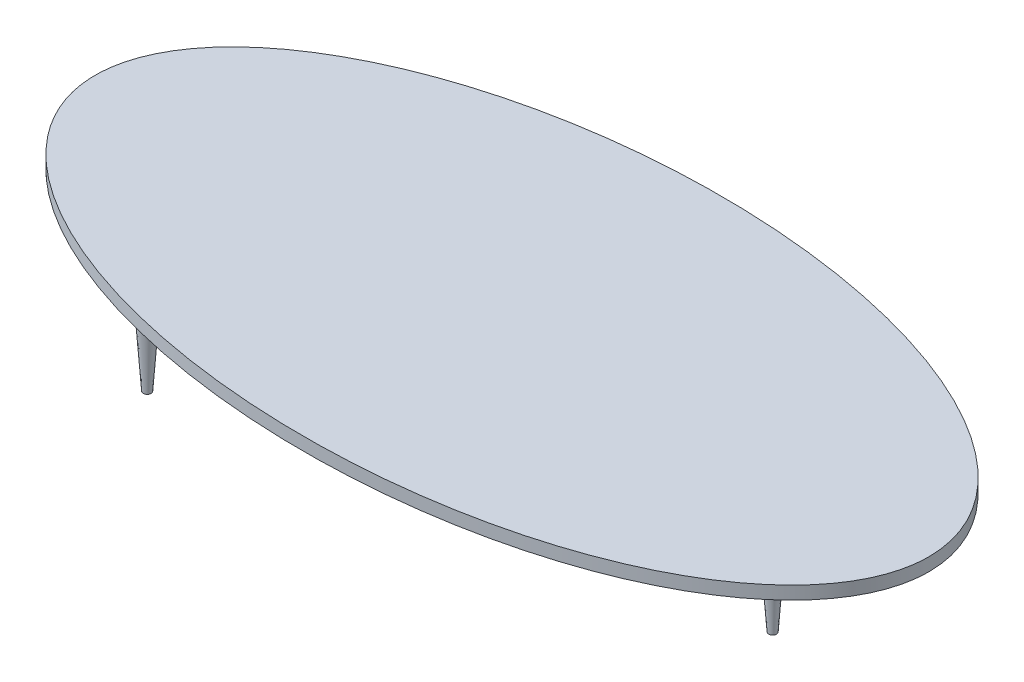
from build123d import *

# Parameters (mm, degrees)
SKETCH2_RX                    = 2438.4
SKETCH2_RY                    = 1219.2
BOSS_EXTRUDE2_DEPTH           = 76.2
SKETCH3_R                     = 76.2
BOSS_EXTRUDE3_DEPTH           = 762
BOSS_EXTRUDE3_DRAFT           = 4
BOSS_EXTRUDE3_PROFILE_2_DEPTH = 762
BOSS_EXTRUDE3_PROFILE_2_DRAFT = 4
BOSS_EXTRUDE3_PROFILE_3_DEPTH = 762
BOSS_EXTRUDE3_PROFILE_3_DRAFT = 4


with BuildPart() as part:
    # Sketch2 → Boss-Extrude2 (new body)
    with BuildSketch(Plane(origin=(0, 0, 0), x_dir=(1, 0, 0), z_dir=(0, 1, 0))):
        with Locations((0, 0)):
            Ellipse(SKETCH2_RX, SKETCH2_RY)
    extrude(amount=BOSS_EXTRUDE2_DEPTH)


with BuildPart() as boss_extrude3_tool:
    # Sketch3 → Boss-Extrude3 (with draft: the straight prism first)
    with BuildSketch(Plane(origin=(0, 0, 0), x_dir=(-1, 0, 0), z_dir=(0, -1, 0))):
        with Locations((1524, -609.6)):
            Circle(SKETCH3_R)
    extrude(amount=BOSS_EXTRUDE3_DEPTH)
    # Boss-Extrude3: the draft: its side faces are tilted about the plane it starts from
    boss_extrude3_sides = [boss_extrude3_tool.faces().sort_by_distance(p)[0] for p in [
        (-1447.8, -381, 609.6),
    ]]
    draft(boss_extrude3_sides, Plane(origin=(0, 0, 0), x_dir=(-1, 0, 0), z_dir=(0, -1, 0)), BOSS_EXTRUDE3_DRAFT)


with BuildPart() as part_1:
    add(part.part)

    # Boss-Extrude3: add boss_extrude3_tool
    add(boss_extrude3_tool.part)


with BuildPart() as boss_extrude3_profile_2_tool:
    # Sketch3 → Boss-Extrude3 profile 2 (with draft: the straight prism first)
    with BuildSketch(Plane(origin=(0, 0, 0), x_dir=(-1, 0, 0), z_dir=(0, -1, 0))):
        with Locations((1524, 609.6)):
            Circle(SKETCH3_R)
    extrude(amount=BOSS_EXTRUDE3_PROFILE_2_DEPTH)
    # Boss-Extrude3 profile 2: the draft: its side faces are tilted about the plane it starts from
    boss_extrude3_profile_2_sides = [boss_extrude3_profile_2_tool.faces().sort_by_distance(p)[0] for p in [
        (-1447.8, -381, -609.6),
    ]]
    draft(boss_extrude3_profile_2_sides, Plane(origin=(0, 0, 0), x_dir=(-1, 0, 0), z_dir=(0, -1, 0)), BOSS_EXTRUDE3_PROFILE_2_DRAFT)


with BuildPart() as part_2:
    add(part_1.part)

    # Boss-Extrude3 profile 2: add boss_extrude3_profile_2_tool
    add(boss_extrude3_profile_2_tool.part)


with BuildPart() as boss_extrude3_profile_3_tool:
    # Sketch3 → Boss-Extrude3 profile 3 (with draft: the straight prism first)
    with BuildSketch(Plane(origin=(0, 0, 0), x_dir=(-1, 0, 0), z_dir=(0, -1, 0))):
        with Locations((-1524, 0)):
            Circle(SKETCH3_R)
    extrude(amount=BOSS_EXTRUDE3_PROFILE_3_DEPTH)
    # Boss-Extrude3 profile 3: the draft: its side faces are tilted about the plane it starts from
    boss_extrude3_profile_3_sides = [boss_extrude3_profile_3_tool.faces().sort_by_distance(p)[0] for p in [
        (1600.2, -381, 0),
    ]]
    draft(boss_extrude3_profile_3_sides, Plane(origin=(0, 0, 0), x_dir=(-1, 0, 0), z_dir=(0, -1, 0)), BOSS_EXTRUDE3_PROFILE_3_DRAFT)


with BuildPart() as part_3:
    add(part_2.part)

    # Boss-Extrude3 profile 3: add boss_extrude3_profile_3_tool
    add(boss_extrude3_profile_3_tool.part)


solid = part_3.part
